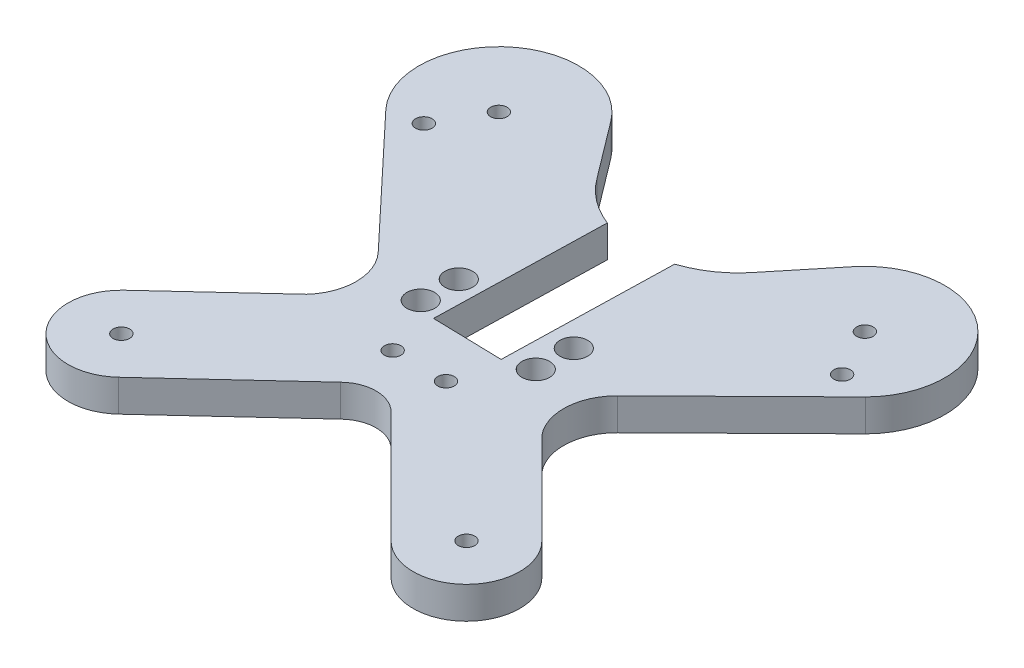
from build123d import *

# Parameters (mm, degrees)
SZKIC13_R                   = 1.55
DODANIE_WYCI_GNI_CIE3_DEPTH = 6
SZKIC15_R                   = 2.6
WYTNIJ_WYCI_GNI_CIE3_DEPTH  = 226.954786153
SZKIC17_R                   = 1.550000001
WYTNIJ_WYCI_GNI_CIE4_DEPTH  = 10
WYTNIJ_WYCI_GNI_CIE5_START  = -10
WYTNIJ_WYCI_GNI_CIE5_DEPTH  = 10
SZKIC19_R                   = 1.55
WYTNIJ_WYCI_GNI_CIE6_DEPTH  = 10


with BuildPart() as part:
    # Szkic13 → Dodanie-wyciągnięcie3 (new body)
    with BuildSketch(Plane(origin=(79.289240162, 6, 79.289240162), x_dir=(-1, 0, 0), z_dir=(0, 1, 0))):
        with BuildLine():
            Line((-25.202360127, 55.749482984), (-3.551339243, 75.782812897))
            ThreePointArc((-3.551339243, 75.782812897), (10.580158874, 75.234396129), (10.031742107, 61.102898012))
            Line((10.031742107, 61.102898012), (-7.738470336, 44.660415673))
            ThreePointArc((-7.738470336, 44.660415673), (-10.310546151, 37.859798404), (-7.5965153, 31.114577446))
            Line((-7.5965153, 31.114577446), (14.933655573, 7.152316182))
            ThreePointArc((14.933655573, 7.152316182), (13.398314201, -14.533932284), (-8.183163771, -11.908964821))
            Line((-8.183163771, -11.908964821), (-15.992976767, -1.557886957))
            ThreePointArc((-15.992976767, -1.557886957), (-22.556998647, 4.097640789), (-30.974241603, 6.152244974))
            ThreePointArc((-30.974241603, 6.152244974), (-39.464828567, 4.425597836), (-46.243228353, -0.971130216))
            Line((-46.243228353, -0.971130216), (-54.448570559, -11.011566026))
            ThreePointArc((-54.448570559, -11.011566026), (-76.115608669, -12.797652588), (-76.808825852, 8.931822684))
            Line((-76.808825852, 8.931822684), (-53.366371193, 32.002364161))
            ThreePointArc((-53.366371193, 32.002364161), (-50.392809402, 38.637264273), (-52.699229936, 45.532508544))
            Line((-52.699229936, 45.532508544), (-69.818454156, 62.651732764))
            ThreePointArc((-69.818454156, 62.651732764), (-69.818454156, 76.793868387), (-55.676318532, 76.793868387))
            Line((-55.676318532, 76.793868387), (-34.818454156, 55.936004011))
            ThreePointArc((-34.818454156, 55.936004011), (-30.049036911, 53.851185216), (-25.202360127, 55.749482984))
        make_face()
        with Locations((-62.747386344, 69.722800575)):
            Circle(SZKIC13_R, mode=Mode.SUBTRACT)
        with Locations(Location((3.855577347, -2.960852601, 0), (0, 0, 180))):
            Circle(SZKIC13_R, mode=Mode.SUBTRACT)
        with Locations(Location((3.240201432, 68.442855454, 0), (0, 0, 180))):
            Circle(SZKIC13_R, mode=Mode.SUBTRACT)
        with Locations((-66.131258172, -1.603335049)):
            Circle(SZKIC13_R, mode=Mode.SUBTRACT)
    extrude(amount=-DODANIE_WYCI_GNI_CIE3_DEPTH)

    # Szkic15 → Wytnij-wyciągnięcie3 (cut, through all)
    with BuildSketch(Plane(origin=(0, 0, 0), x_dir=(0.707106781186548, 0, 0.7071067811865471), z_dir=(0, -1, 0))):
        with Locations(Location((145.72647023, 5.947865628, 0), (0, 0, 315))):
            Circle(SZKIC15_R)
        with Locations(Location((150.579295842, 10.992673214, 0), (0, 0, 315))):
            Circle(SZKIC15_R)
        with Locations(Location((161.581579785, -9.30387201, 0), (0, 0, 315))):
            Circle(SZKIC15_R)
        with Locations(Location((166.434405397, -4.259064425, 0), (0, 0, 315))):
            Circle(SZKIC15_R)
    extrude(amount=-WYTNIJ_WYCI_GNI_CIE3_DEPTH, mode=Mode.SUBTRACT)

    # Szkic17 → Wytnij-wyciągnięcie4 (cut)
    with BuildSketch(Plane(origin=(0, 0, 0), x_dir=(0.7071067811865479, 0, 0.7071067811865472), z_dir=(0, -1, 0))):
        with Locations(Location((109.947888172, 10.585151125, 0), (0, 0, 225))):
            Circle(SZKIC17_R)
        with Locations(Location((167.602832009, -44.875713015, 0), (0, 0, 225))):
            Circle(SZKIC17_R)
    extrude(amount=-WYTNIJ_WYCI_GNI_CIE4_DEPTH, mode=Mode.SUBTRACT)

    # Szkic18 → Wytnij-wyciągnięcie5 (cut)
    with BuildSketch(Plane.XZ.offset(WYTNIJ_WYCI_GNI_CIE5_START)):
        with BuildLine():
            Line((116.622706822, 84.5530515), (115.830023537, 116.303650978))
            Line((115.830023537, 116.303650978), (102.834025094, 115.981122728))
            Line((102.834025094, 115.981122728), (103.61834975, 84.184343244))
            ThreePointArc((103.61834975, 84.184343244), (106.883098894, 85.118528612), (110.263481765, 85.441485136))
            ThreePointArc((110.263481765, 85.441485136), (113.481855081, 85.274710056), (116.622706822, 84.5530515))
        make_face()
    extrude(amount=WYTNIJ_WYCI_GNI_CIE5_DEPTH, mode=Mode.SUBTRACT)

    # Szkic19 → Wytnij-wyciągnięcie6 (cut)
    with BuildSketch(Plane.XZ):
        with Locations((104.20638679, 125.017952482)):
            Circle(SZKIC19_R)
        with Locations((114.20638679, 125.017952482)):
            Circle(SZKIC19_R)
    extrude(amount=-WYTNIJ_WYCI_GNI_CIE6_DEPTH, mode=Mode.SUBTRACT)


solid = part.part
